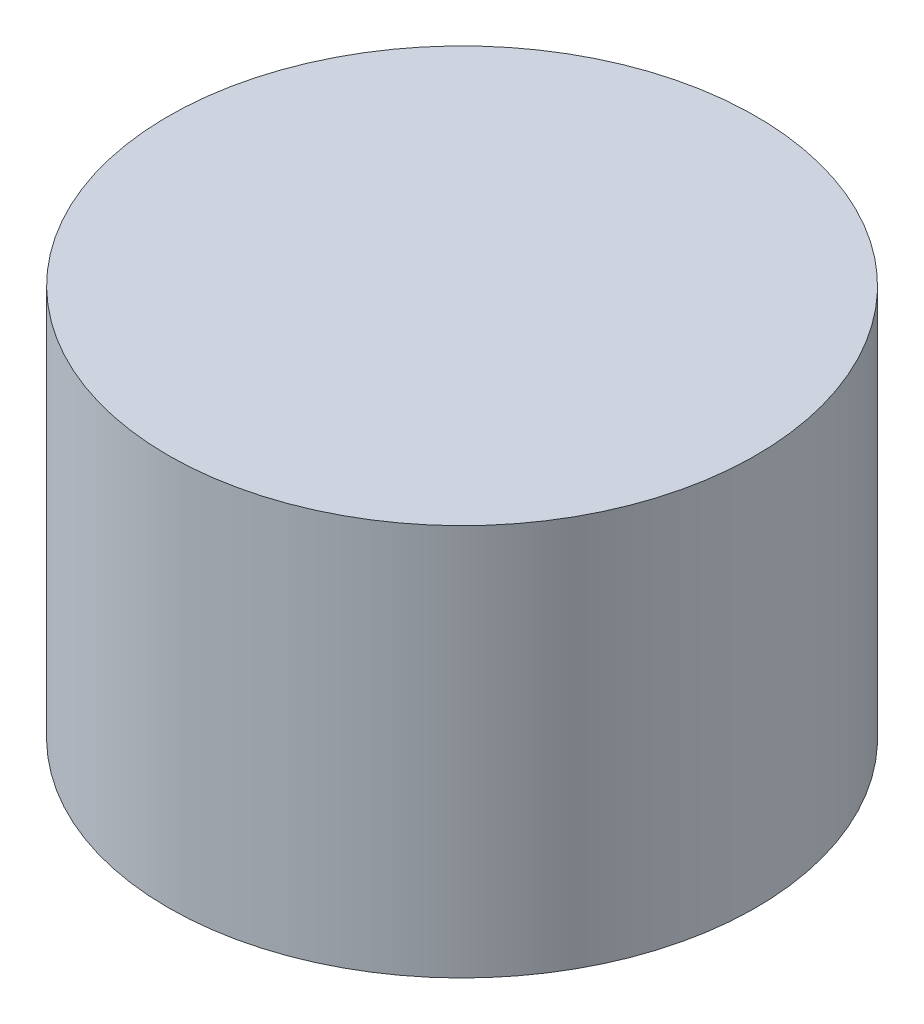
from build123d import *

# Parameters (mm, degrees)
SKETCH1_R           = 19.05
BOSS_EXTRUDE1_DEPTH = 25.4


with BuildPart() as part:
    # Sketch1 → Boss-Extrude1 (new body)
    with BuildSketch(Plane(origin=(0, 0, 0), x_dir=(1, 0, 0), z_dir=(0, 1, 0))):
        with Locations(Location((0, 0, 0), (0, 0, 270))):
            Circle(SKETCH1_R)
    extrude(amount=BOSS_EXTRUDE1_DEPTH)


solid = part.part
